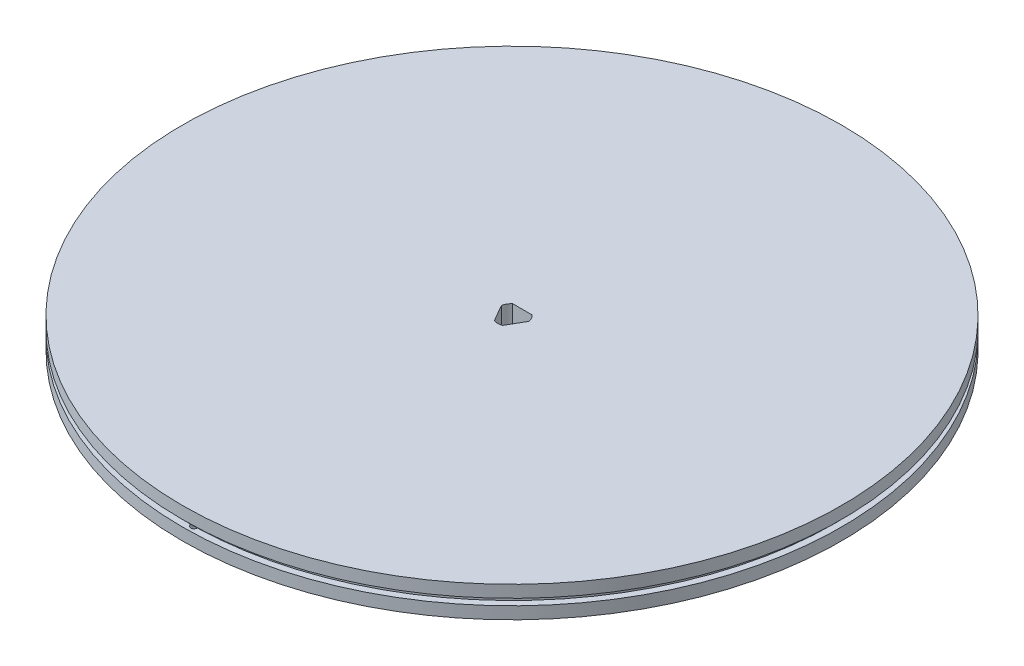
from build123d import *

# Parameters (mm, degrees)
ESBO_O1_R                = 51
RESSALTO_EXTRUS_O1_DEPTH = 2.38125
ESBO_O2_R                = 51
ESBO_O2_R_2              = 50
CORTE_EXTRUS_O1_DEPTH    = 0.5
ESBO_O3_R                = 0.5
CORTE_EXTRUS_O2_DEPTH    = 1.88125
CORTE_EXTRUS_O3_DEPTH    = 73.281957681


with BuildPart() as part:
    # Esboço1 → Ressalto-extrusão1 (new, symmetric)
    with BuildSketch(Plane(origin=(0, 0, 0), x_dir=(1, 0, 0), z_dir=(0, 1, 0))):
        with Locations(Location((0, 0, 0), (0, 0, 90))):
            Circle(ESBO_O1_R)
    extrude(amount=RESSALTO_EXTRUS_O1_DEPTH, both=True)

    # Esboço2 → Corte-extrusão1 (cut, symmetric)
    with BuildSketch(Plane(origin=(0, 0, 0), x_dir=(1, 0, 0), z_dir=(0, 1, 0))):
        with Locations(Location((0, 0, 0), (0, 0, 90))):
            Circle(ESBO_O2_R)
        with Locations(Location((0, 0, 0), (0, 0, 270))):
            Circle(ESBO_O2_R_2, mode=Mode.SUBTRACT)
    extrude(amount=CORTE_EXTRUS_O1_DEPTH, both=True, mode=Mode.SUBTRACT)

    # Esboço3 → Corte-extrusão2 (cut)
    with BuildSketch(Plane(origin=(0, -0.5, 0), x_dir=(1, 0, 0), z_dir=(0, 1, 0))):
        with Locations(Location((0.789504293, -50, 0), (0, 0, 270))):
            Circle(ESBO_O3_R)
    extrude(amount=-CORTE_EXTRUS_O2_DEPTH, mode=Mode.SUBTRACT)

    # Esboço4 → Corte-extrusão3 (cut, through all)
    with BuildSketch(Plane(origin=(0, 2.38125, 0), x_dir=(1, 0, 0), z_dir=(0, 1, 0))):
        with BuildLine():
            Line((-2.14062409, 0.507669683), (-0.630657203, -2.107669683))
            ThreePointArc((-0.630657203, -2.107669683), (0, -2.2), (0.630657203, -2.107669683))
            Line((0.630657203, -2.107669683), (2.14062409, 0.507669683))
            ThreePointArc((2.14062409, 0.507669683), (1.905255888, 1.1), (1.509966887, 1.6))
            Line((1.509966887, 1.6), (-1.509966887, 1.6))
            ThreePointArc((-1.509966887, 1.6), (-1.905255888, 1.1), (-2.14062409, 0.507669683))
        make_face()
    extrude(amount=-CORTE_EXTRUS_O3_DEPTH, mode=Mode.SUBTRACT)


solid = part.part
